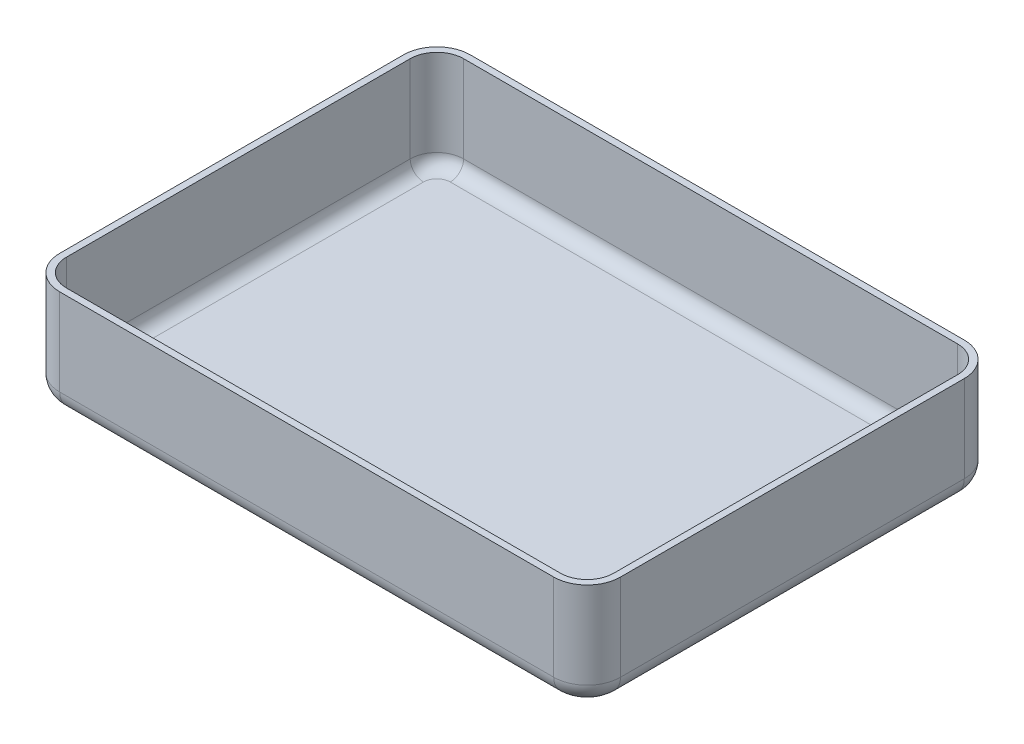
from build123d import *

# Parameters (mm, degrees)
BOSS_EXTRUDE1_DEPTH = 15
FILLET1_R           = 4
SHELL1_T            = 2


with BuildPart() as part:
    # Sketch1 → Boss-Extrude1 (new, symmetric)
    with BuildSketch(Plane(origin=(0, 0, 0), x_dir=(1, 0, 0), z_dir=(0, 1, 0))):
        with BuildLine():
            Line((-74, 59.5), (74, 59.5))
            ThreePointArc((74, 59.5), (79.656854249, 57.156854249), (82, 51.5))
            Line((82, 51.5), (82, -51.5))
            ThreePointArc((82, -51.5), (79.656854249, -57.156854249), (74, -59.5))
            Line((74, -59.5), (-74, -59.5))
            ThreePointArc((-74, -59.5), (-79.656854249, -57.156854249), (-82, -51.5))
            Line((-82, -51.5), (-82, 51.5))
            ThreePointArc((-82, 51.5), (-79.656854249, 57.156854249), (-74, 59.5))
        make_face()
    extrude(amount=BOSS_EXTRUDE1_DEPTH, both=True)

    # Fillet1
    fillet1_edges = [part.edges().sort_by_distance(p)[0] for p in [
        (-79.656854249, -15, -57.156854249),
        (-82, -15, 0),
        (-79.656854249, -15, 57.156854249),
        (0, -15, 59.5),
        (79.656854249, -15, 57.156854249),
        (82, -15, 0),
        (79.656854249, -15, -57.156854249),
        (0, -15, -59.5),
    ]]
    fillet(fillet1_edges, radius=FILLET1_R)

    # Shell1
    shell1_openings = [part.faces().sort_by_distance(p)[0] for p in [
        (0, 15, 0),
    ]]
    offset(amount=SHELL1_T, openings=shell1_openings, kind=Kind.INTERSECTION)


solid = part.part
